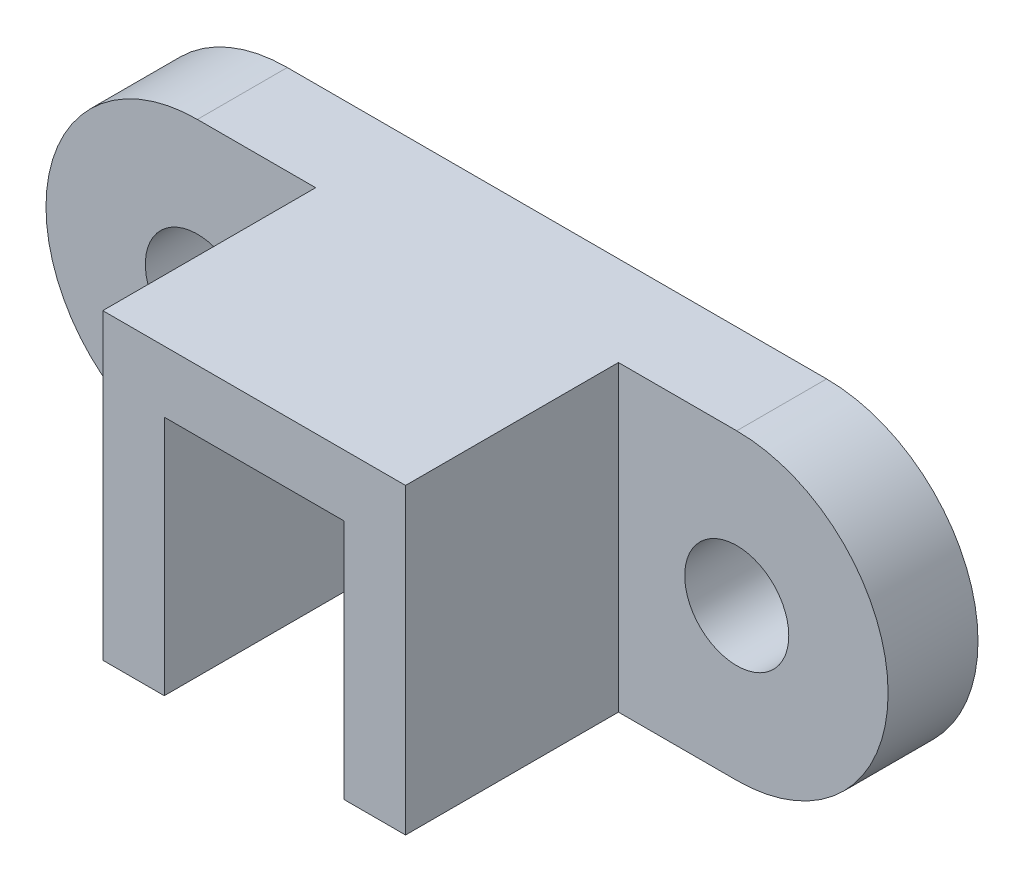
from build123d import *

# Parameters (mm, degrees)
BOSS_EXTRUDE1_DEPTH = 19
SKETCH2_R           = 11
CUT_EXTRUDE1_DEPTH  = 97.467611145
SKETCH3_W           = 64
SKETCH3_H           = 64
BOSS_EXTRUDE2_DEPTH = 45
SKETCH4_W           = 38
SKETCH4_H           = 51
CUT_EXTRUDE2_DEPTH  = 51
BOSS_EXTRUDE3_DEPTH = 38


with BuildPart() as part:
    # Sketch1 → Boss-Extrude1 (new body)
    with BuildSketch(Plane.XY):
        with BuildLine():
            Line((-57, 32), (57, 32))
            ThreePointArc((57, 32), (89, 0), (57, -32))
            Line((57, -32), (-57, -32))
            ThreePointArc((-57, -32), (-89, 0), (-57, 32))
        make_face()
    extrude(amount=BOSS_EXTRUDE1_DEPTH)

    # Sketch2 → Cut-Extrude1 (cut, through all)
    with BuildSketch(Plane.XY.offset(19)):
        with Locations((-57, 0)):
            Circle(SKETCH2_R)
        with Locations((57, 0)):
            Circle(SKETCH2_R)
    extrude(amount=-CUT_EXTRUDE1_DEPTH, mode=Mode.SUBTRACT)

    # Sketch3 → Boss-Extrude2 (add)
    with BuildSketch(Plane.XY.offset(19)):
        Rectangle(SKETCH3_W, SKETCH3_H)
    extrude(amount=BOSS_EXTRUDE2_DEPTH)

    # Sketch4 → Cut-Extrude2 (cut)
    with BuildSketch(Plane.XZ.offset(32)):
        with Locations((0, 38.5)):
            Rectangle(SKETCH4_W, SKETCH4_H)
    extrude(amount=-CUT_EXTRUDE2_DEPTH, mode=Mode.SUBTRACT)

    # Sketch5 → Boss-Extrude3 (add)
    with BuildSketch(Plane.ZY.offset(-19)):
        Polygon((64, 19), (13, -32), (13, 19), align=None)
    extrude(amount=BOSS_EXTRUDE3_DEPTH)


solid = part.part
